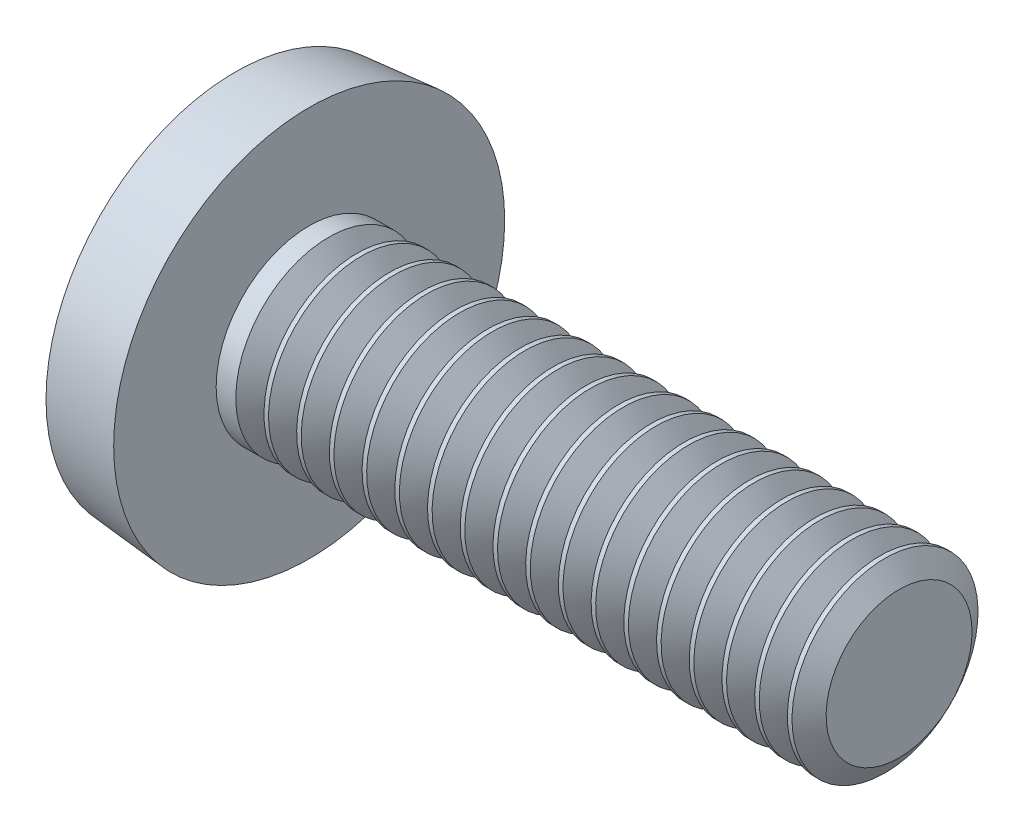
from build123d import *

# Parameters (mm, degrees)
CIRPATTERN1_COUNT = 2
CIRPATTERN1_ANGLE = 90
THDSCHPAT_COUNT   = 18
THDSCHPAT_PITCH   = 0.616323529


with BuildPart() as part:
    # BodySke → Base-Revolve (revolve)
    with BuildSketch(Plane.XY, mode=Mode.PRIVATE) as base_revolve_sk:
        with BuildLine():
            Line((2.2098, 1.7526), (2.2098, 3.683))
            Line((2.2098, 3.683), (0.8128, 3.560778337))
            ThreePointArc((0.8128, 3.560778337), (0.205780131, 1.826183603), (0, 0))
            Line((0, 0), (13.3223, 0))
            Line((13.3223, 0), (13.3223, 1.7526))
            Line((13.3223, 1.7526), (2.2098, 1.7526))
        make_face()
    revolve(base_revolve_sk.sketch.rotate(Axis((-25.4, 0, 0), (1, 0, 0)), 90), axis=Axis((-25.4, 0, 0), (1, 0, 0)))

    # Sketch3 → Cross section 0
    with BuildSketch(Plane(origin=(0, 0, 0), x_dir=(0, 0, -1), z_dir=(1, 0, 0))):
        with BuildLine():
            Line((-0.4953, 2.413), (0.4953, 2.413))
            Line((0.4953, 2.413), (0.4953, -2.413))
            Line((0.4953, -2.413), (-0.4953, -2.413))
            Line((-0.4953, -2.413), (-0.4953, 2.413))
        make_face()
    # Sketch4 → Cross section 1
    with BuildSketch(Plane(origin=(2.794, 0, 0), x_dir=(0, 0, -1), z_dir=(1, 0, 0))):
        with BuildLine():
            Line((-0.24765, 0.24765), (0.24765, 0.24765))
            Line((0.24765, 0.24765), (0.24765, -0.24765))
            Line((0.24765, -0.24765), (-0.24765, -0.24765))
            Line((-0.24765, -0.24765), (-0.24765, 0.24765))
        make_face()
    cross = loft(mode=Mode.SUBTRACT)

    # CirPattern1: Cross ×2 about axis
    cirpattern1_axis = Axis((0, 0, 0), (1, 0, 0))
    for i in range(1, CIRPATTERN1_COUNT):
        add(cross.rotate(cirpattern1_axis, i * CIRPATTERN1_ANGLE / (CIRPATTERN1_COUNT - 1)), mode=Mode.SUBTRACT)

    # ThdSchSke → ThreadSchematic (revolve, cut)
    with BuildSketch(Plane.XY, mode=Mode.PRIVATE) as threadschematic_sk:
        Polygon((2.8448, -1.37414), (2.579799455, -1.7526), (2.579799455, -2.19075), (3.109800545, -2.19075), (3.109800545, -1.7526), align=None)
    threadschematic = revolve(threadschematic_sk.sketch.rotate(Axis((-3.175, 0, 0), (1, 0, 0)), 270), axis=Axis((-3.175, 0, 0), (1, 0, 0)), mode=Mode.SUBTRACT)

    # ThdSchPat: ThreadSchematic ×18
    with Locations(*[(i * THDSCHPAT_PITCH, 0, 0) for i in range(1, THDSCHPAT_COUNT)]):
        add(threadschematic, mode=Mode.SUBTRACT)


solid = part.part
